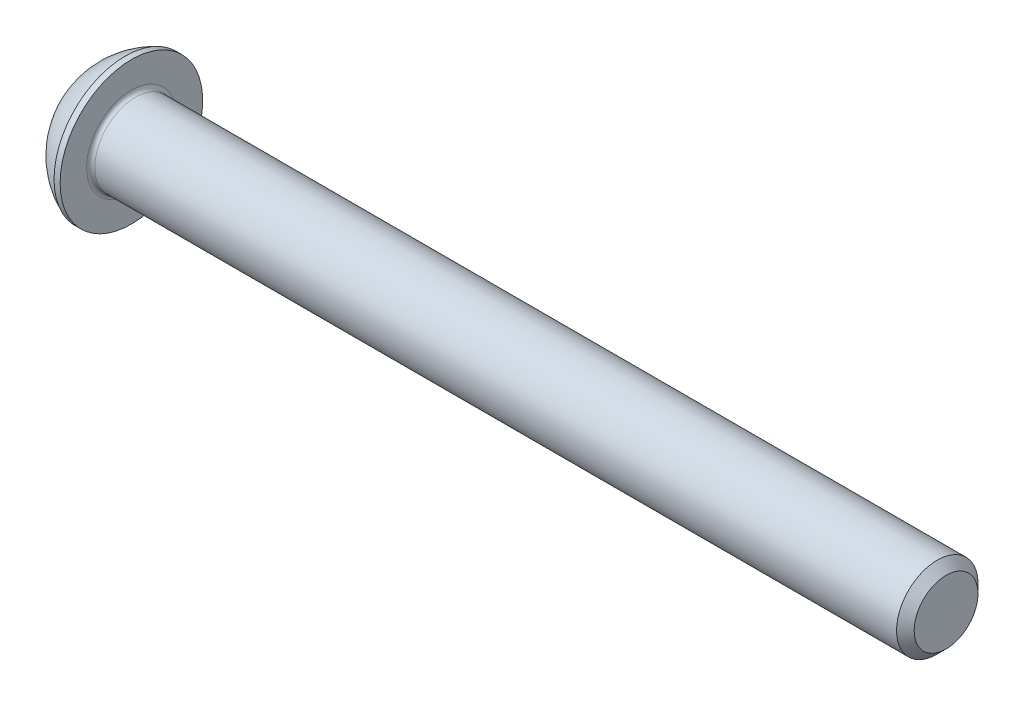
from build123d import *

# Parameters (mm, degrees)
FILLET1_R   = 0.1
HEX_2_DEPTH = 0.6


with BuildPart() as part:
    # BodySke → BaseBody (revolve)
    with BuildSketch(Plane.XY, mode=Mode.PRIVATE) as basebody_sk:
        with BuildLine():
            Line((21.1, 0), (21.1, 0.7835))
            Line((21.1, 0.7835), (20.8835, 1))
            Line((20.8835, 1), (1.1, 1))
            Line((1.1, 1), (1.1, 1.75))
            Line((1.1, 1.75), (0.95, 1.75))
            ThreePointArc((0.95, 1.75), (0.398268526, 1.395808457), (0, 0.875))
            Line((0, 0.875), (0, 0))
            Line((0, 0), (21.1, 0))
        make_face()
    revolve(basebody_sk.sketch.rotate(Axis((0, 0, 0), (1, 0, 0)), 90), axis=Axis((0, 0, 0), (1, 0, 0)))

    # Fillet1
    fillet1_edges = [part.edges().sort_by_distance(p)[0] for p in [
        (1.1, 0, -1),
    ]]
    fillet(fillet1_edges, radius=FILLET1_R)

    # Sketch2 → PreBroach (revolve, cut)
    with BuildSketch(Plane.XY, mode=Mode.PRIVATE) as prebroach_sk:
        Polygon((0, 0.715), (0.6, 0.715), (1.012805442, 0), (0, 0), align=None)
    revolve(prebroach_sk.sketch.rotate(Axis((0, 0, 0), (1, 0, 0)), 90), axis=Axis((0, 0, 0), (1, 0, 0)), mode=Mode.SUBTRACT)

    # Sketch3 → Hex 2 (cut)
    with BuildSketch(Plane(origin=(0, 0, 0), x_dir=(0, 0, -1), z_dir=(1, 0, 0))):
        Polygon((-0.65, -0.375277675), (-0.65, 0.375277675), (0, 0.75055535), (0.65, 0.375277675), (0.65, -0.375277675), (0, -0.75055535), align=None)
    extrude(amount=HEX_2_DEPTH, mode=Mode.SUBTRACT)


solid = part.part
